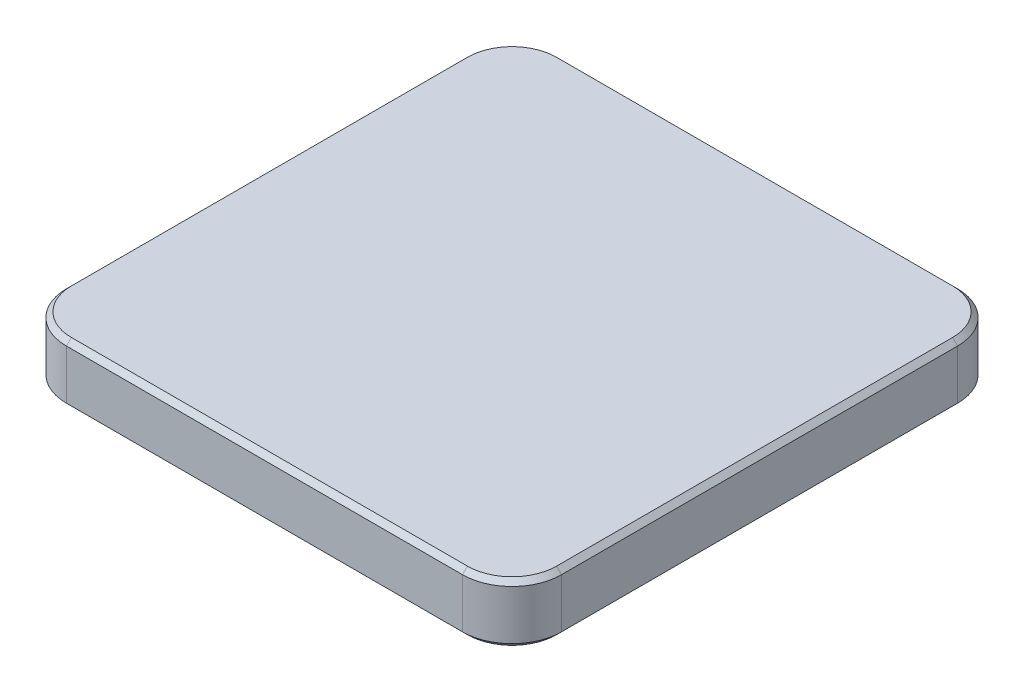
from build123d import *

# Parameters (mm, degrees)
BOSS_EXTRUDE1_DEPTH = 12
CHAMFER1_SIZE       = 1


with BuildPart() as part:
    # Sketch1 → Boss-Extrude1 (new body)
    with BuildSketch(Plane(origin=(0, 0, 0), x_dir=(1, 0, 0), z_dir=(0, 1, 0))):
        with BuildLine():
            Line((-40, 50), (40, 50))
            ThreePointArc((40, 50), (47.071067812, 47.071067812), (50, 40))
            Line((50, 40), (50, -40))
            ThreePointArc((50, -40), (47.071067812, -47.071067812), (40, -50))
            Line((40, -50), (-40, -50))
            ThreePointArc((-40, -50), (-47.071067812, -47.071067812), (-50, -40))
            Line((-50, -40), (-50, 40))
            ThreePointArc((-50, 40), (-47.071067812, 47.071067812), (-40, 50))
        make_face()
    extrude(amount=BOSS_EXTRUDE1_DEPTH)

    # Chamfer1
    chamfer1_edges = [part.edges().sort_by_distance(p)[0] for p in [
        (50, 0, 0),
        (47.071067812, 0, 47.071067812),
        (0, 0, 50),
        (-47.071067812, 0, 47.071067812),
        (47.071067812, 12, 47.071067812),
        (50, 12, 0),
        (47.071067812, 12, -47.071067812),
        (0, 12, -50),
        (-47.071067812, 12, -47.071067812),
        (-50, 12, 0),
        (-47.071067812, 12, 47.071067812),
        (-50, 0, 0),
        (0, 12, 50),
        (-47.071067812, 0, -47.071067812),
        (0, 0, -50),
        (47.071067812, 0, -47.071067812),
    ]]
    chamfer(chamfer1_edges, length=CHAMFER1_SIZE)


solid = part.part
